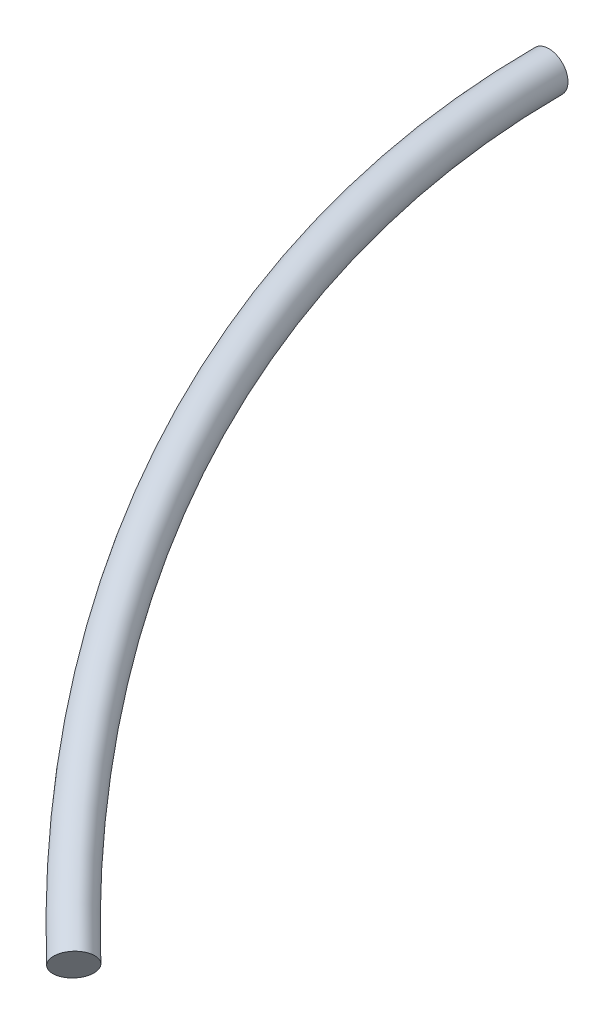
from build123d import *

# Parameters (mm, degrees)
SKETCH1_R = 50.8


with BuildPart() as part:
    # Sweep1: sweep along a path in Sketch2
    with BuildLine(Plane(origin=(-7294.557341161, -11330.669308117, 0), x_dir=(-0.4625960949452944, 0.2978141580708109, 0.8350518428181202), z_dir=(0.5413117287675313, 0.8408219860937907, -3.5249581031848716e-15))) as sweep1_path:
        ThreePointArc((-2228.97158783, 3383.140766466), (-1393.77613514, 4257.135283609), (-1023.092774961, 5407.792359664))
    # Sketch1 → Sweep1 (sweep)
    with BuildSketch(Plane.XY):
        with Locations((-3888.039335171, -13523.747250176)):
            Circle(SKETCH1_R)
    sweep(path=sweep1_path.line)


solid = part.part
